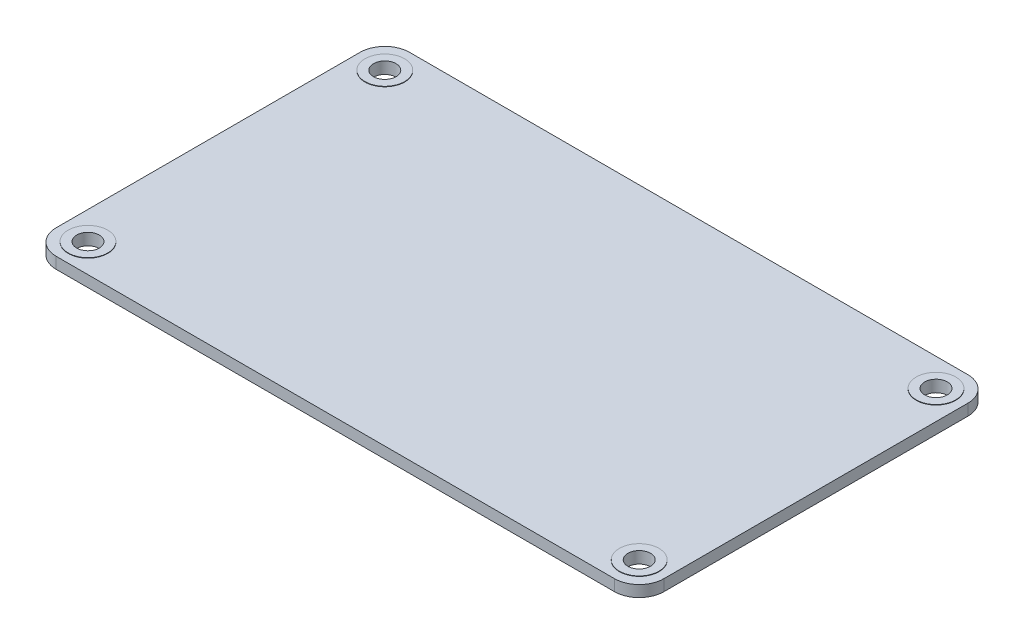
from build123d import *

# Parameters (mm, degrees)
SKETCH_1_W          = 86
SKETCH_1_H          = 50
EXTRUDE_1_DEPTH     = 1.6
SKETCH_2_R          = 2.8
SKETCH_2_R_2        = 1.6
EXTRUDE_2_DEPTH     = 0.06
SKETCH_4_R          = 1.6
CUT_EXTRUDE_1_DEPTH = 50.765047975
FILLET_1_R          = 3.5


with BuildPart() as part:
    # 草图1 → 凸台-拉伸1 (new body)
    with BuildSketch(Plane(origin=(0, 0, 0), x_dir=(1, 0, 0), z_dir=(0, 1, 0))):
        Rectangle(SKETCH_1_W, SKETCH_1_H)
    extrude(amount=EXTRUDE_1_DEPTH)

    # 草图2 → 凸台-拉伸2 (add)
    # profile 1 of 4: a face of its own
    with BuildSketch(Plane(origin=(0, 1.6, 0), x_dir=(1, 0, 0), z_dir=(0, 1, 0))):
        with Locations(Location((-39, 21, 0), (0, 0, 90))):
            Circle(SKETCH_2_R)
        with Locations(Location((-39, 21, 0), (0, 0, 270))):
            Circle(SKETCH_2_R_2, mode=Mode.SUBTRACT)
    # profile 2 of 4: a face of its own
    with BuildSketch(Plane(origin=(0, 1.6, 0), x_dir=(1, 0, 0), z_dir=(0, 1, 0))):
        with Locations(Location((39, 21, 0), (0, 0, 90))):
            Circle(SKETCH_2_R)
        with Locations(Location((39, 21, 0), (0, 0, 270))):
            Circle(SKETCH_2_R_2, mode=Mode.SUBTRACT)
    # profile 3 of 4: a face of its own
    with BuildSketch(Plane(origin=(0, 1.6, 0), x_dir=(1, 0, 0), z_dir=(0, 1, 0))):
        with Locations(Location((39, -21, 0), (0, 0, 90))):
            Circle(SKETCH_2_R)
        with Locations(Location((39, -21, 0), (0, 0, 270))):
            Circle(SKETCH_2_R_2, mode=Mode.SUBTRACT)
    # profile 4 of 4: a face of its own
    with BuildSketch(Plane(origin=(0, 1.6, 0), x_dir=(1, 0, 0), z_dir=(0, 1, 0))):
        with Locations(Location((-39, -21, 0), (0, 0, 90))):
            Circle(SKETCH_2_R)
        with Locations(Location((-39, -21, 0), (0, 0, 270))):
            Circle(SKETCH_2_R_2, mode=Mode.SUBTRACT)
    extrude(amount=EXTRUDE_2_DEPTH)

    # 草图4 → 切除-拉伸1 (cut, through all)
    with BuildSketch(Plane(origin=(0, 1.6, 0), x_dir=(1, 0, 0), z_dir=(0, 1, 0))):
        with Locations(Location((-39, 21, 0), (0, 0, 270))):
            Circle(SKETCH_4_R)
        with Locations(Location((39, 21, 0), (0, 0, 270))):
            Circle(SKETCH_4_R)
        with Locations(Location((39, -21, 0), (0, 0, 270))):
            Circle(SKETCH_4_R)
        with Locations(Location((-39, -21, 0), (0, 0, 270))):
            Circle(SKETCH_4_R)
    extrude(amount=-CUT_EXTRUDE_1_DEPTH, mode=Mode.SUBTRACT)

    # 圆角1
    fillet_1_edges = [part.edges().sort_by_distance(p)[0] for p in [
        (43, 0.8, 25),
        (-43, 0.8, 25),
        (-43, 0.8, -25),
        (43, 0.8, -25),
    ]]
    fillet(fillet_1_edges, radius=FILLET_1_R)


solid = part.part
